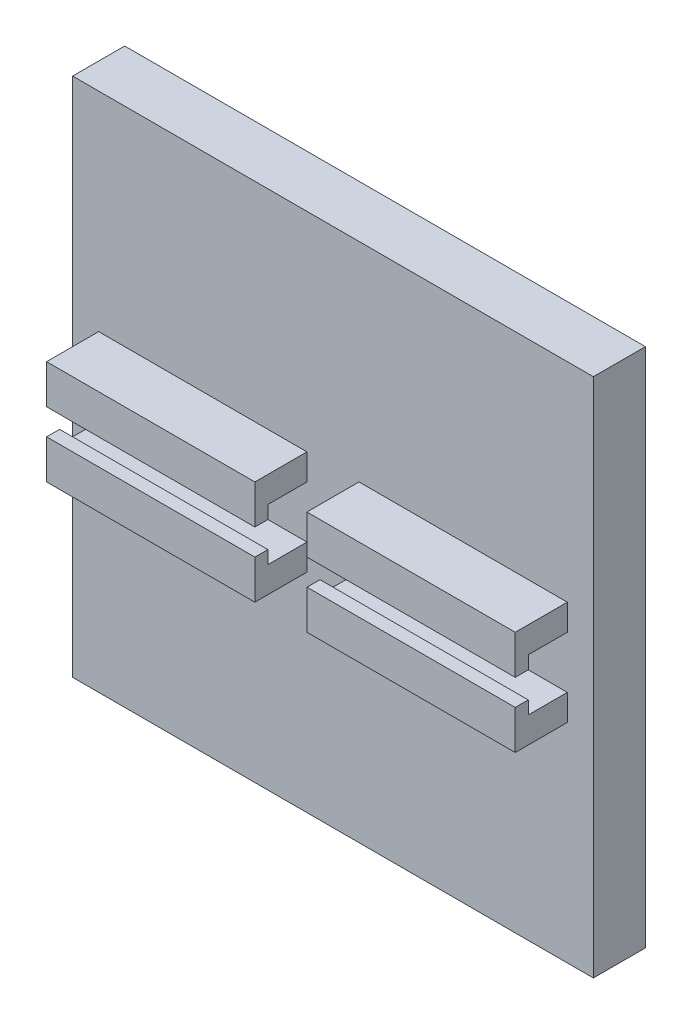
from build123d import *

# Parameters (mm, degrees)
SKETCH1_W               = 100
SKETCH1_H               = 100
BACK_PLATE_DEPTH        = 10
SKETCH2_W               = 40
SKETCH2_H               = 20
SLIDER_MOUNT_BOSS_DEPTH = 10
SLIDER_MOUNT_DEPTH      = 77.974021592


with BuildPart() as part:
    # Sketch1 → back plate (new body)
    with BuildSketch(Plane.XY):
        Rectangle(SKETCH1_W, SKETCH1_H)
    extrude(amount=BACK_PLATE_DEPTH)

    # Sketch2 → slider mount boss (add)
    with BuildSketch(Plane.XY.offset(10)):
        with Locations((-25, 0)):
            Rectangle(SKETCH2_W, SKETCH2_H)
    slider_mount_boss = extrude(amount=SLIDER_MOUNT_BOSS_DEPTH)

    # Sketch3 → slider mount (cut, through all)
    with BuildSketch(Plane(origin=(-5, 0, 0), x_dir=(0, 0, -1), z_dir=(1, 0, 0))):
        Polygon((-17.5, 5), (-10, 5), (-10, -5), (-17.5, -5), (-17.5, -2.5), (-20, -2.5), (-20, 2.5), (-17.5, 2.5), align=None)
    slider_mount = extrude(amount=-SLIDER_MOUNT_DEPTH, mode=Mode.SUBTRACT)

    # Mirror3: slider mount boss, slider mount across plane
    add(slider_mount_boss.mirror(Plane(origin=(0, 0, 0), x_dir=(0, 0, 1), z_dir=(1, 0, 0))))
    add(slider_mount.mirror(Plane(origin=(0, 0, 0), x_dir=(0, 0, 1), z_dir=(1, 0, 0))), mode=Mode.SUBTRACT)


solid = part.part
